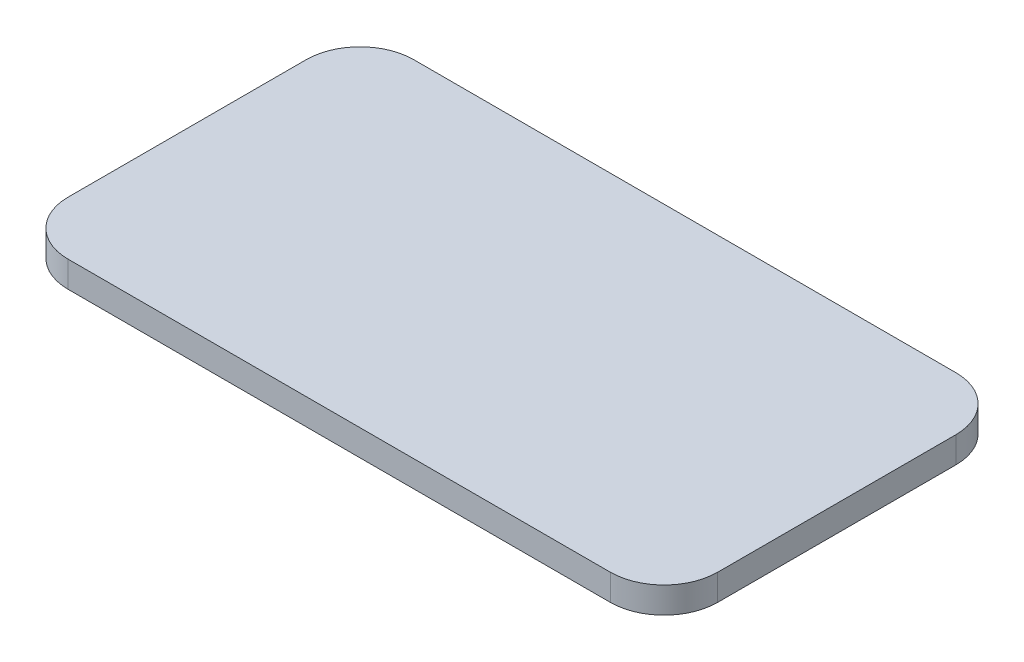
from build123d import *

# Parameters (mm, degrees)
SKETCH_1_W      = 36.28
SKETCH_1_H      = 19.3
EXTRUDE_1_DEPTH = 1.46
FILLET_1_R      = 3


with BuildPart() as part:
    # 草图1 → 凸台-拉伸1 (new body)
    with BuildSketch(Plane(origin=(0, 0, 0), x_dir=(1, 0, 0), z_dir=(0, 1, 0))):
        with Locations((18.14, 9.65)):
            Rectangle(SKETCH_1_W, SKETCH_1_H)
    extrude(amount=EXTRUDE_1_DEPTH)

    # 圆角1
    fillet_1_edges = [part.edges().sort_by_distance(p)[0] for p in [
        (0, 0.73, -19.3),
        (36.28, 0.73, -19.3),
        (36.28, 0.73, 0),
        (0, 0.73, 0),
    ]]
    fillet(fillet_1_edges, radius=FILLET_1_R)


solid = part.part
